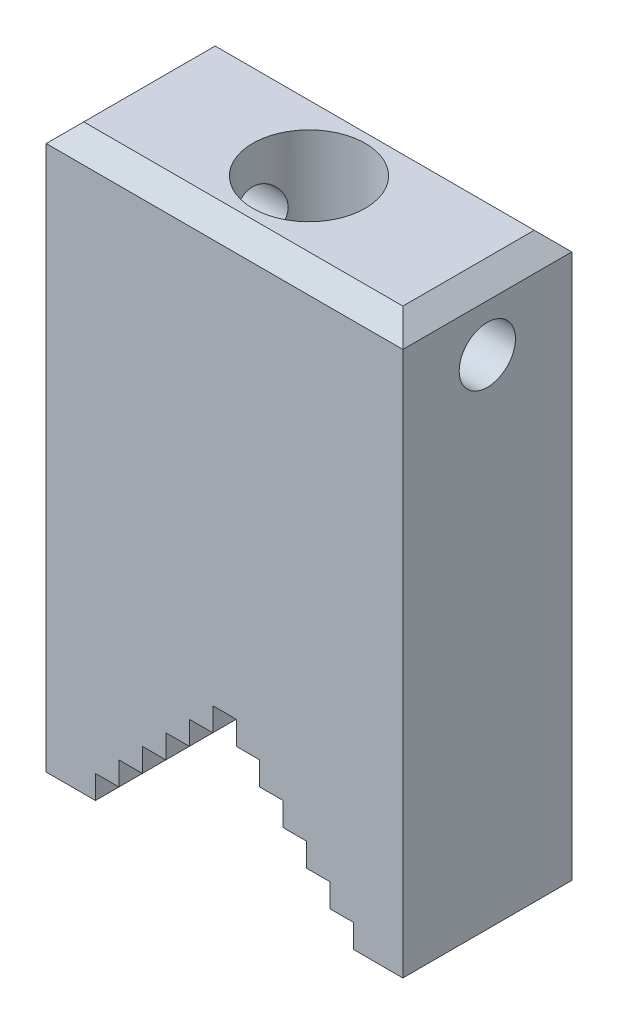
from build123d import *

# Parameters (mm, degrees)
BOSS_EXTRUDE1_DEPTH        = 9
F_12_0MM_DOWEL_HOLE1_D     = 12
F_12_0MM_DOWEL_HOLE1_DEPTH = 18
F_12_0MM_DOWEL_HOLE1_TIP   = 4.047051101
SKETCH6_R                  = 3
CUT_EXTRUDE1_DEPTH         = 50.244289009
CHAMFER1_SIZE              = 2


with BuildPart() as part:
    # Sketch1 → Boss-Extrude1 (new, symmetric)
    with BuildSketch(Plane.XY):
        Polygon((-19, 30), (19, 30), (19, -30), (13.75, -30), (13.75, -27.5), (11.25, -27.5), (11.25, -25), (8.75, -25), (8.75, -22.5), (6.25, -22.5), (6.25, -20), (3.75, -20), (3.75, -17.5), (1.25, -17.5), (1.25, -15), (-1.25, -15), (-1.25, -17.5), (-3.75, -17.5), (-3.75, -20), (-6.25, -20), (-6.25, -22.5), (-8.75, -22.5), (-8.75, -25), (-11.25, -25), (-11.25, -27.5), (-13.75, -27.5), (-13.75, -30), (-19, -30), align=None)
    extrude(amount=BOSS_EXTRUDE1_DEPTH, both=True)

    # Ø12.0mm Dowel Hole1
    with Locations(Plane(origin=(-0.020341947, 30, -0.020341947), x_dir=(1, 0, 0), z_dir=(0, 1, 0))):
        with Locations((0, 0)):
            Hole(F_12_0MM_DOWEL_HOLE1_D / 2, depth=F_12_0MM_DOWEL_HOLE1_DEPTH)
            with Locations((0, 0, -(F_12_0MM_DOWEL_HOLE1_DEPTH + F_12_0MM_DOWEL_HOLE1_TIP / 2))):  # 112° drill point
                Cone(0, F_12_0MM_DOWEL_HOLE1_D / 2, F_12_0MM_DOWEL_HOLE1_TIP, mode=Mode.SUBTRACT)

    # Sketch6 → Cut-Extrude1 (cut, through all)
    with BuildSketch(Plane.ZY.offset(19)):
        with Locations((0, 23)):
            Circle(SKETCH6_R)
    extrude(amount=-CUT_EXTRUDE1_DEPTH, mode=Mode.SUBTRACT)

    # Chamfer1
    chamfer1_edges = [part.edges().sort_by_distance(p)[0] for p in [
        (0, 30, 9),
        (0, 30, -9),
        (-19, 30, 0),
        (19, 30, 0),
    ]]
    chamfer(chamfer1_edges, length=CHAMFER1_SIZE)


solid = part.part
